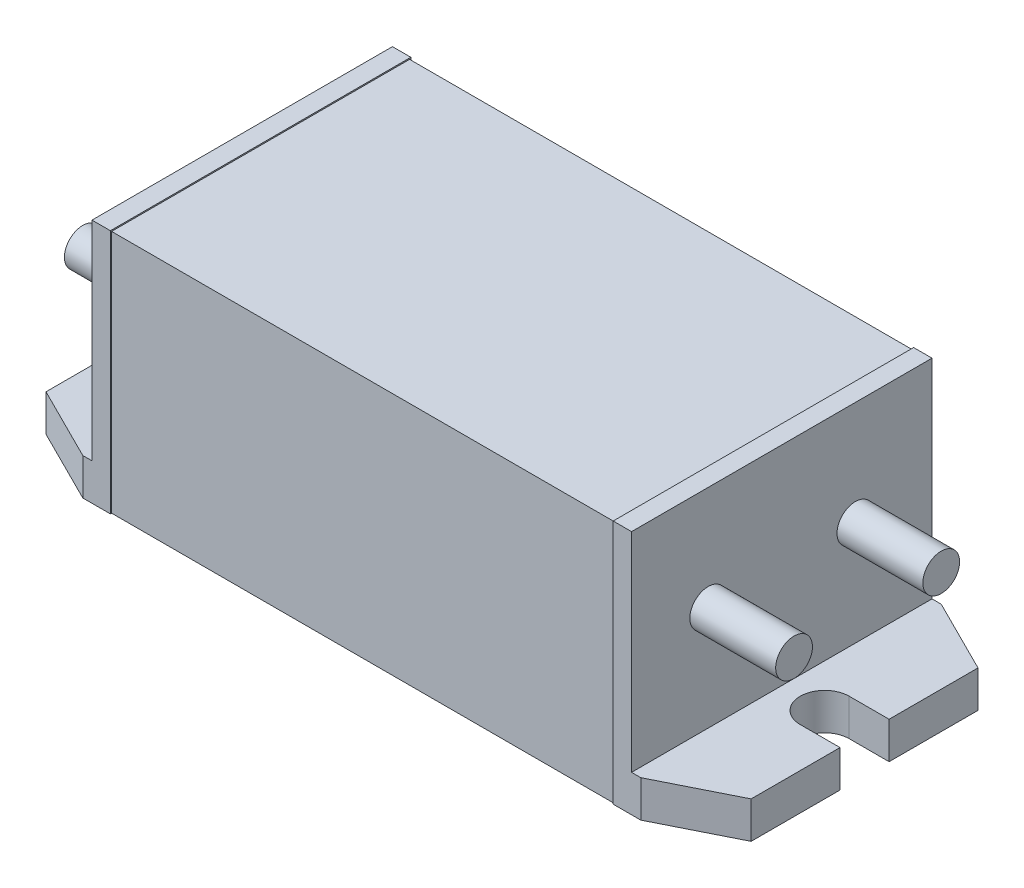
from build123d import *
from OCP.BRepFilletAPI import BRepFilletAPI_MakeChamfer

# Parameters (mm, degrees)
SKETCH_1_W          = 44
SKETCH_1_H          = 24.5
EXTRUDE_1_DEPTH     = 20
SKETCH_2_W          = 57.5
SKETCH_2_H          = 24.5
EXTRUDE_2_DEPTH     = 3
CHAMFER_1_SIZE      = 3
CHAMFER_1_SIZE2     = 6
CHAMFER_2_SIZE      = 6
CHAMFER_2_SIZE2     = 3
CUT_EXTRUDE_1_DEPTH = 36.575623677
SKETCH_4_R          = 1.5
EXTRUDE_3_DEPTH     = 7
CUT_EXTRUDE_2_DEPTH = 20.5


with BuildPart() as part:
    # 草图1 → 凸台-拉伸1 (new body)
    with BuildSketch(Plane(origin=(0, 0, 0), x_dir=(1, 0, 0), z_dir=(0, 1, 0))):
        Rectangle(SKETCH_1_W, SKETCH_1_H)
    extrude(amount=EXTRUDE_1_DEPTH)

    # 草图2 → 凸台-拉伸2 (add)
    with BuildSketch(Plane.XZ):
        Rectangle(SKETCH_2_W, SKETCH_2_H)
    extrude(amount=-EXTRUDE_2_DEPTH)

    # 倒角1: one chamfer whose edges measure the first distance from different faces: ONE call of the kernel's chamfer builder (chamfer() names one face for all edges)
    chamfer_1_edges_1 = [part.edges().sort_by_distance(p)[0] for p in [
        (-28.75, 1.5, 12.25),
    ]]
    chamfer_1_side_1 = [part.faces().sort_by_distance(p)[0] for p in [
        (-28.75, 1.5, 0),
    ]]
    chamfer_1_edges_2 = [part.edges().sort_by_distance(p)[0] for p in [
        (28.75, 1.5, -12.25),
    ]]
    chamfer_1_side_2 = [part.faces().sort_by_distance(p)[0] for p in [
        (28.75, 1.5, 0),
    ]]
    chamfer_1 = BRepFilletAPI_MakeChamfer(part.part.solid().wrapped)
    for e in chamfer_1_edges_1:
        chamfer_1.Add(CHAMFER_1_SIZE, CHAMFER_1_SIZE2, e.wrapped, chamfer_1_side_1[0].wrapped)  # the first distance lies on this face
    for e in chamfer_1_edges_2:
        chamfer_1.Add(CHAMFER_1_SIZE, CHAMFER_1_SIZE2, e.wrapped, chamfer_1_side_2[0].wrapped)  # the first distance lies on this face
    add(Compound.cast(chamfer_1.Shape()), mode=Mode.REPLACE)

    # 倒角2: one chamfer whose edges measure the first distance from different faces: ONE call of the kernel's chamfer builder (chamfer() names one face for all edges)
    chamfer_2_edges_1 = [part.edges().sort_by_distance(p)[0] for p in [
        (-28.75, 1.5, -12.25),
    ]]
    chamfer_2_side_1 = [part.faces().sort_by_distance(p)[0] for p in [
        (-0.513573407, 9.788088643, -12.25),
    ]]
    chamfer_2_edges_2 = [part.edges().sort_by_distance(p)[0] for p in [
        (28.75, 1.5, 12.25),
    ]]
    chamfer_2_side_2 = [part.faces().sort_by_distance(p)[0] for p in [
        (0.513573407, 9.788088643, 12.25),
    ]]
    chamfer_2 = BRepFilletAPI_MakeChamfer(part.part.solid().wrapped)
    for e in chamfer_2_edges_1:
        chamfer_2.Add(CHAMFER_2_SIZE, CHAMFER_2_SIZE2, e.wrapped, chamfer_2_side_1[0].wrapped)  # the first distance lies on this face
    for e in chamfer_2_edges_2:
        chamfer_2.Add(CHAMFER_2_SIZE, CHAMFER_2_SIZE2, e.wrapped, chamfer_2_side_2[0].wrapped)  # the first distance lies on this face
    add(Compound.cast(chamfer_2.Shape()), mode=Mode.REPLACE)

    # 草图3 → 切除-拉伸1 (cut, through all)
    with BuildSketch(Plane(origin=(0, 3, 0), x_dir=(1, 0, 0), z_dir=(0, 1, 0))):
        with BuildLine():
            Line((-25.5, 2), (-28.75, 2))
            Line((-28.75, 2), (-28.75, -2))
            Line((-28.75, -2), (-25.5, -2))
            ThreePointArc((-25.5, -2), (-23.5, 0), (-25.5, 2))
        make_face()
        with BuildLine():
            Line((28.75, -2), (25.5, -2))
            ThreePointArc((25.5, -2), (23.5, 0), (25.5, 2))
            Line((25.5, 2), (28.75, 2))
            Line((28.75, 2), (28.75, -2))
        make_face()
    extrude(amount=-CUT_EXTRUDE_1_DEPTH, mode=Mode.SUBTRACT)

    # 草图4 → 凸台-拉伸3 (add)
    with BuildSketch(Plane.ZY.offset(22)):
        with Locations(Location((-6, 11.5, 0), (0, 0, 180))):
            Circle(SKETCH_4_R)
        with Locations(Location((6, 11.5, 0), (0, 0, 180))):
            Circle(SKETCH_4_R)
    extrude_3 = extrude(amount=EXTRUDE_3_DEPTH)

    # 镜向1: 凸台-拉伸3 across plane
    add(extrude_3.mirror(Plane.ZY))

    # 草图5 → 切除-拉伸2 (cut, symmetric)
    with BuildSketch(Plane(origin=(0, 0, 0), x_dir=(0, 0, -1), z_dir=(1, 0, 0))):
        Polygon((-12.25, 3), (-12.25, 0), (-12.15, 0), (-12.15, 3.1), (-12.15, 19.9), (12.15, 19.9), (12.15, 3.1), (12.15, 0), (12.25, 0), (12.25, 3), (12.25, 20), (-12.25, 20), align=None)
    extrude(amount=CUT_EXTRUDE_2_DEPTH, both=True, mode=Mode.SUBTRACT)


solid = part.part
